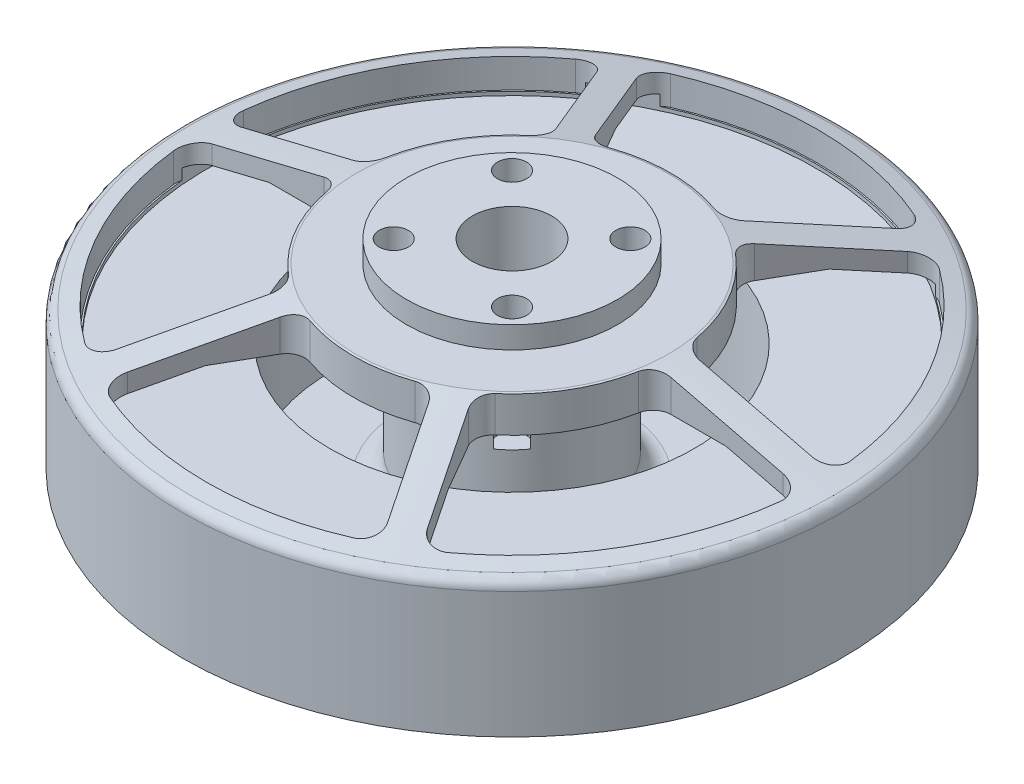
from build123d import *

# Parameters (mm, degrees)
CUT_EXTRUDE_4_DEPTH = 9
SKETCH_3_R          = 2
SKETCH_3_R_2        = 5.44
CUT_EXTRUDE_1_DEPTH = 16.3
SKETCH_4_R          = 1.5
SKETCH_4_R_2        = 2
CUT_EXTRUDE_2_DEPTH = 10
EXTRUDE_1_DEPTH     = 1.5
SKETCH_6_R          = 12.25
SKETCH_6_R_2        = 8
CUT_EXTRUDE_3_DEPTH = 4
SKETCH_8_R          = 8
CUT_EXTRUDE_5_DEPTH = 0.3


with BuildPart() as part:
    # 草图2 → 旋转1 (revolve)
    with BuildSketch(Plane.XY, mode=Mode.PRIVATE) as revolve_1_sk:
        with BuildLine():
            Line((0, 0), (-29.5, 0))
            Line((-29.5, 0), (-29.5, 1))
            Line((-29.5, 1), (-26.7, 1))
            Line((-26.7, 1), (-26.7, 7.1))
            Line((-26.7, 7.1), (-41.8, 7.1))
            Line((-41.8, 7.1), (-41.8, 6.1))
            Line((-41.8, 6.1), (-45.3, 6.1))
            Line((-45.3, 6.1), (-45.3, 22.2))
            Line((-45.3, 22.2), (-45.3, 23.421603629))
            ThreePointArc((-45.3, 23.421603629), (-44.97954438, 24.348250841), (-44.155099927, 24.878965644))
            Line((-44.155099927, 24.878965644), (-21.496278748, 30.4))
            Line((-21.496278748, 30.4), (-14.5, 30.4))
            Line((-14.5, 30.4), (-14.5, 33.4))
            Line((-14.5, 33.4), (0, 33.4))
            Line((0, 33.4), (0, 30.4))
            Line((0, 30.4), (0, 22.2))
            Line((0, 22.2), (0, 0))
        make_face()
        with BuildLine():
            Line((-25, 5), (-25, 20.87966543))
            Line((-25, 20.87966543), (-41.8, 20.87966543))
            Line((-41.8, 20.87966543), (-41.8, 22.87966543))
            Line((-41.8, 22.87966543), (-31.45632042, 25.4))
            Line((-31.45632042, 25.4), (-12.5, 25.4))
            Line((-12.5, 25.4), (-12.5, 8))
            ThreePointArc((-12.5, 8), (-13.378679656, 5.878679656), (-15.5, 5))
            Line((-15.5, 5), (-25, 5))
        make_face(mode=Mode.SUBTRACT)
    revolve(revolve_1_sk.sketch.rotate(Axis((0, 22.2, 0), (0, -1, 0)), 270), axis=Axis((0, 22.2, 0), (0, -1, 0)))

    # 草图7 → 切除-拉伸4 (cut)
    with BuildSketch(Plane(origin=(0, 30.4, 0), x_dir=(1, 0, 0), z_dir=(0, 1, 0))):
        with BuildLine():
            Line((-17.889366063, 34.985290936), (-10.207798438, 21.680425528))
            ThreePointArc((-10.207798438, 21.680425528), (-8.911545672, 20.586248083), (-7.215293063, 20.571328251))
            ThreePointArc((-7.215293063, 20.571328251), (0, 21.8), (7.215293063, 20.571328251))
            ThreePointArc((7.215293063, 20.571328251), (8.911545672, 20.586248083), (10.207798438, 21.680425528))
            Line((10.207798438, 21.680425528), (17.889366063, 34.985290936))
            ThreePointArc((17.889366063, 34.985290936), (18.0982662, 37.019061695), (16.719511576, 38.52866378))
            ThreePointArc((16.719511576, 38.52866378), (0, 42), (-16.719511576, 38.52866378))
            ThreePointArc((-16.719511576, 38.52866378), (-18.0982662, 37.019061695), (-17.889366063, 34.985290936))
        make_face()
        with BuildLine():
            Line((39.242833741, 2), (23.879698491, 2))
            ThreePointArc((23.879698491, 2), (22.283986644, 2.575499103), (21.422939387, 4.037037037))
            ThreePointArc((21.422939387, 4.037037037), (18.879353803, 10.9), (14.207646323, 16.534291214))
            ThreePointArc((14.207646323, 16.534291214), (13.372440973, 18.01074898), (13.671900053, 19.680425528))
            Line((13.671900053, 19.680425528), (21.353467678, 32.985290936))
            ThreePointArc((21.353467678, 32.985290936), (23.010314752, 34.183089141), (25.007045819, 33.743853653))
            ThreePointArc((25.007045819, 33.743853653), (36.373066959, 21), (41.726557395, 4.784810127))
            ThreePointArc((41.726557395, 4.784810127), (41.108580952, 2.835972554), (39.242833741, 2))
        make_face()
        with BuildLine():
            Line((21.353467678, -32.985290936), (13.671900053, -19.680425528))
            ThreePointArc((13.671900053, -19.680425528), (13.372440973, -18.01074898), (14.207646323, -16.534291214))
            ThreePointArc((14.207646323, -16.534291214), (18.879353803, -10.9), (21.422939387, -4.037037037))
            ThreePointArc((21.422939387, -4.037037037), (22.283986644, -2.575499103), (23.879698491, -2))
            Line((23.879698491, -2), (39.242833741, -2))
            ThreePointArc((39.242833741, -2), (41.108580952, -2.835972554), (41.726557395, -4.784810127))
            ThreePointArc((41.726557395, -4.784810127), (36.373066959, -21), (25.007045819, -33.743853653))
            ThreePointArc((25.007045819, -33.743853653), (23.010314752, -34.183089141), (21.353467678, -32.985290936))
        make_face()
        with BuildLine():
            Line((-17.889366063, -34.985290936), (-10.207798438, -21.680425528))
            ThreePointArc((-10.207798438, -21.680425528), (-8.911545672, -20.586248083), (-7.215293063, -20.571328251))
            ThreePointArc((-7.215293063, -20.571328251), (0, -21.8), (7.215293063, -20.571328251))
            ThreePointArc((7.215293063, -20.571328251), (8.911545672, -20.586248083), (10.207798438, -21.680425528))
            Line((10.207798438, -21.680425528), (17.889366063, -34.985290936))
            ThreePointArc((17.889366063, -34.985290936), (18.0982662, -37.019061695), (16.719511576, -38.52866378))
            ThreePointArc((16.719511576, -38.52866378), (0, -42), (-16.719511576, -38.52866378))
            ThreePointArc((-16.719511576, -38.52866378), (-18.0982662, -37.019061695), (-17.889366063, -34.985290936))
        make_face()
        with BuildLine():
            Line((-39.242833741, -2), (-23.879698491, -2))
            ThreePointArc((-23.879698491, -2), (-22.283986644, -2.575499103), (-21.422939387, -4.037037037))
            ThreePointArc((-21.422939387, -4.037037037), (-18.879353803, -10.9), (-14.207646323, -16.534291214))
            ThreePointArc((-14.207646323, -16.534291214), (-13.372440973, -18.01074898), (-13.671900053, -19.680425528))
            Line((-13.671900053, -19.680425528), (-21.353467678, -32.985290936))
            ThreePointArc((-21.353467678, -32.985290936), (-23.010314752, -34.183089141), (-25.007045819, -33.743853653))
            ThreePointArc((-25.007045819, -33.743853653), (-36.373066959, -21), (-41.726557395, -4.784810127))
            ThreePointArc((-41.726557395, -4.784810127), (-41.108580952, -2.835972554), (-39.242833741, -2))
        make_face()
        with BuildLine():
            Line((-21.353467678, 32.985290936), (-13.671900053, 19.680425528))
            ThreePointArc((-13.671900053, 19.680425528), (-13.372440973, 18.01074898), (-14.207646323, 16.534291214))
            ThreePointArc((-14.207646323, 16.534291214), (-18.879353803, 10.9), (-21.422939387, 4.037037037))
            ThreePointArc((-21.422939387, 4.037037037), (-22.283986644, 2.575499103), (-23.879698491, 2))
            Line((-23.879698491, 2), (-39.242833741, 2))
            ThreePointArc((-39.242833741, 2), (-41.108580952, 2.835972554), (-41.726557395, 4.784810127))
            ThreePointArc((-41.726557395, 4.784810127), (-36.373066959, 21), (-25.007045819, 33.743853653))
            ThreePointArc((-25.007045819, 33.743853653), (-23.010314752, 34.183089141), (-21.353467678, 32.985290936))
        make_face()
    extrude(amount=-CUT_EXTRUDE_4_DEPTH, mode=Mode.SUBTRACT)

    # 草图3 → 切除-拉伸1 (cut)
    with BuildSketch(Plane(origin=(0, 33.4, 0), x_dir=(1, 0, 0), z_dir=(0, 1, 0))):
        with Locations(Location((-8.131727984, -8.131727984, 0), (0, 0, 270))):
            Circle(SKETCH_3_R)
        with Locations(Location((-8.131727984, 8.131727984, 0), (0, 0, 270))):
            Circle(SKETCH_3_R)
        with Locations(Location((8.131727984, 8.131727984, 0), (0, 0, 270))):
            Circle(SKETCH_3_R)
        with Locations(Location((8.131727984, -8.131727984, 0), (0, 0, 270))):
            Circle(SKETCH_3_R)
        with Locations(Location((0, 0, 0), (0, 0, 270))):
            Circle(SKETCH_3_R_2)
    extrude(amount=-CUT_EXTRUDE_1_DEPTH, mode=Mode.SUBTRACT)

    # 草图4 → 切除-拉伸2 (cut)
    with BuildSketch(Plane.XZ):
        with Locations(Location((0, 15, 0), (0, 0, 270))):
            Circle(SKETCH_4_R)
        with Locations(Location((15, 0, 0), (0, 0, 270))):
            Circle(SKETCH_4_R)
        with Locations(Location((0, -15, 0), (0, 0, 270))):
            Circle(SKETCH_4_R)
        with Locations(Location((-15, 0, 0), (0, 0, 270))):
            Circle(SKETCH_4_R)
        with Locations(Location((-11.313708499, 11.313708499, 0), (0, 0, 270))):
            Circle(SKETCH_4_R_2)
        with Locations(Location((11.313708499, 11.313708499, 0), (0, 0, 270))):
            Circle(SKETCH_4_R_2)
        with Locations(Location((11.313708499, -11.313708499, 0), (0, 0, 270))):
            Circle(SKETCH_4_R_2)
        with Locations(Location((-11.313708499, -11.313708499, 0), (0, 0, 270))):
            Circle(SKETCH_4_R_2)
    extrude(amount=-CUT_EXTRUDE_2_DEPTH, mode=Mode.SUBTRACT)

    # 草图6 → 切除-拉伸3 (cut)
    with BuildSketch(Plane.XZ):
        with Locations(Location((0, 0, 0), (0, 0, 270))):
            Circle(SKETCH_6_R)
        with Locations(Location((0, 0, 0), (0, 0, 270))):
            Circle(SKETCH_6_R_2, mode=Mode.SUBTRACT)
    extrude(amount=-CUT_EXTRUDE_3_DEPTH, mode=Mode.SUBTRACT)

    # 草图8 → 切除-拉伸5 (cut)
    with BuildSketch(Plane.XZ):
        with Locations(Location((0, 0, 0), (0, 0, 270))):
            Circle(SKETCH_8_R)
    extrude(amount=-CUT_EXTRUDE_5_DEPTH, mode=Mode.SUBTRACT)


with BuildPart() as body_2:
    # 草图5 → 凸台-拉伸1 (new body)
    with BuildSketch(Plane.XZ):
        with BuildLine():
            Line((-8.5, -28.248893784), (-8.5, -39.248893784))
            ThreePointArc((-8.5, -39.248893784), (-7.914213562, -40.663107346), (-6.5, -41.248893784))
            Line((-6.5, -41.248893784), (6.5, -41.248893784))
            ThreePointArc((6.5, -41.248893784), (7.914213562, -40.663107346), (8.5, -39.248893784))
            Line((8.5, -39.248893784), (8.5, -28.248893784))
            Line((8.5, -28.248893784), (1.129556472, -23.20472193))
            ThreePointArc((1.129556472, -23.20472193), (0, -22.855207367), (-1.129556472, -23.20472193))
            Line((-1.129556472, -23.20472193), (-8.5, -28.248893784))
        make_face()
    extrude(amount=EXTRUDE_1_DEPTH)


solid = Compound([part.part, body_2.part])
